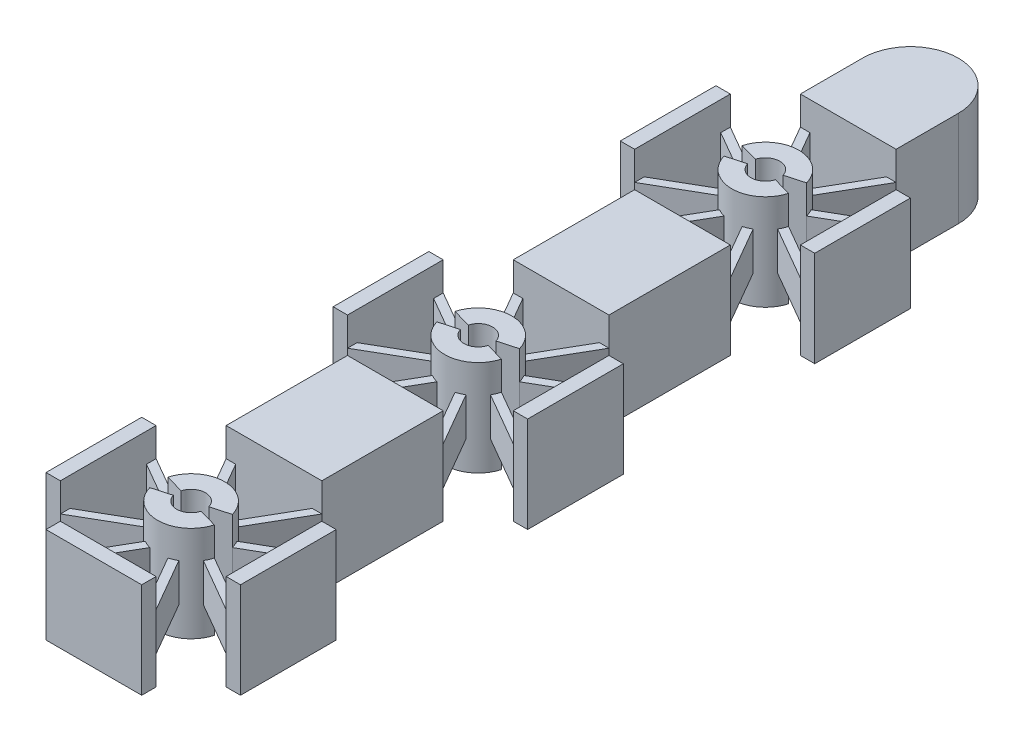
from build123d import *

# Parameters (mm, degrees)
SKETCH1_W                     = 10
SKETCH1_H                     = 1.5
BASE_BUTTERFLY_BLOCKS_DEPTH   = 5
SKETCH1_W_2                   = 1.5
SKETCH1_H_2                   = 10
BASE_BUTTERFLY_BLOCKS_2_DEPTH = 5
BASE_BUTTERFLY_BLOCKS_3_DEPTH = 5
BASE_BUTTERFLY_BLOCKS_4_DEPTH = 5
BASE_BUTTERFLY_BLOCKS_5_DEPTH = 5
BASE_BUTTERFLY_BLOCKS_6_DEPTH = 5
BASE_BUTTERFLY_FLEXURES_DEPTH = 2
LPATTERN1_COUNT               = 3
LPATTERN1_PITCH               = 30
SKETCH3_W                     = 10
SKETCH3_H                     = 10
PIP_DEPTH                     = 9.679491924
SKETCH5_W                     = 10
SKETCH5_H                     = 10
BOSS_EXTRUDE7_DEPTH           = 9.679491924
SKETCH6_W                     = 10
SKETCH6_H                     = 5
BOSS_EXTRUDE9_DEPTH           = 10


with BuildPart() as part:
    # Sketch1 → base_butterfly_blocks (new, symmetric)
    with BuildSketch(Plane(origin=(0, 0, 0), x_dir=(1, 0, 0), z_dir=(0, 1, 0))):
        with Locations((0, -9.410254038)):
            Rectangle(SKETCH1_W, SKETCH1_H)
    extrude(amount=BASE_BUTTERFLY_BLOCKS_DEPTH, both=True)



with BuildPart() as body_2:
    # Sketch1 → base_butterfly_blocks 2 (new, symmetric)
    with BuildSketch(Plane(origin=(0, 0, 0), x_dir=(1, 0, 0), z_dir=(0, 1, 0))):
        with Locations((-9.410254038, 0)):
            Rectangle(SKETCH1_W_2, SKETCH1_H_2)
    extrude(amount=BASE_BUTTERFLY_BLOCKS_2_DEPTH, both=True)


with BuildPart() as body_3:
    # Sketch1 → base_butterfly_blocks 3 (new, symmetric)
    with BuildSketch(Plane(origin=(0, 0, 0), x_dir=(1, 0, 0), z_dir=(0, 1, 0))):
        with Locations((0, 9.410254038)):
            Rectangle(SKETCH1_W, SKETCH1_H)
    extrude(amount=BASE_BUTTERFLY_BLOCKS_3_DEPTH, both=True)


with BuildPart() as body_4:
    # Sketch1 → base_butterfly_blocks 4 (new, symmetric)
    with BuildSketch(Plane(origin=(0, 0, 0), x_dir=(1, 0, 0), z_dir=(0, 1, 0))):
        with Locations((9.410254038, 0)):
            Rectangle(SKETCH1_W_2, SKETCH1_H_2)
    extrude(amount=BASE_BUTTERFLY_BLOCKS_4_DEPTH, both=True)


with BuildPart() as body_5:
    # Sketch1 → base_butterfly_blocks 5 (new, symmetric)
    with BuildSketch(Plane(origin=(0, 0, 0), x_dir=(1, 0, 0), z_dir=(0, 1, 0))):
        with BuildLine():
            Line((-1.444220457, 0.405249641), (-3.369847733, 0.945582496))
            ThreePointArc((-3.369847733, 0.945582496), (0, 3.5), (3.369847733, 0.945582496))
            Line((3.369847733, 0.945582496), (1.444220457, 0.405249641))
            ThreePointArc((1.444220457, 0.405249641), (0, 1.5), (-1.444220457, 0.405249641))
        make_face()
    extrude(amount=BASE_BUTTERFLY_BLOCKS_5_DEPTH, both=True)


with BuildPart() as body_6:
    # Sketch1 → base_butterfly_blocks 6 (new, symmetric)
    with BuildSketch(Plane(origin=(0, 0, 0), x_dir=(1, 0, 0), z_dir=(0, 1, 0))):
        with BuildLine():
            ThreePointArc((-1.444220457, -0.405249641), (0, -1.5), (1.444220457, -0.405249641))
            Line((1.444220457, -0.405249641), (3.369847733, -0.945582496))
            ThreePointArc((3.369847733, -0.945582496), (0, -3.5), (-3.369847733, -0.945582496))
            Line((-3.369847733, -0.945582496), (-1.444220457, -0.405249641))
        make_face()
    extrude(amount=BASE_BUTTERFLY_BLOCKS_6_DEPTH, both=True)


with BuildPart() as part_1:
    add(part.part)

    add(body_2.part)  # base_butterfly_flexures merges body 2

    add(body_3.part)  # base_butterfly_flexures merges body 3

    add(body_4.part)  # base_butterfly_flexures merges body 4

    add(body_5.part)  # base_butterfly_flexures merges body 5

    add(body_6.part)  # base_butterfly_flexures merges body 6
    # Sketch1<4> → base_butterfly_flexures (add, symmetric)
    with BuildSketch(Plane(origin=(0, 0, 0), x_dir=(1, 0, 0), z_dir=(0, 1, 0))):
        with BuildLine():
            Line((-8.660254038, 5), (-8.660254038, 4))
            Line((-8.660254038, 4), (-3.369847733, 0.945582496))
            ThreePointArc((-3.369847733, 0.945582496), (-3.225642474, 1.358392665), (-3.031088913, 1.75))
            Line((-3.031088913, 1.75), (-8.660254038, 5))
        make_face()
        with BuildLine():
            Line((-5, 8.660254038), (-1.75, 3.031088913))
            ThreePointArc((-1.75, 3.031088913), (-1.358392665, 3.225642474), (-0.945582496, 3.369847733))
            Line((-0.945582496, 3.369847733), (-4, 8.660254038))
            Line((-4, 8.660254038), (-5, 8.660254038))
        make_face()
        with BuildLine():
            Line((4, 8.660254038), (0.945582496, 3.369847733))
            ThreePointArc((0.945582496, 3.369847733), (1.358392665, 3.225642474), (1.75, 3.031088913))
            Line((1.75, 3.031088913), (5, 8.660254038))
            Line((5, 8.660254038), (4, 8.660254038))
        make_face()
        with BuildLine():
            Line((3.369847733, 0.945582496), (8.660254038, 4))
            Line((8.660254038, 4), (8.660254038, 5))
            Line((8.660254038, 5), (3.031088913, 1.75))
            ThreePointArc((3.031088913, 1.75), (3.225642474, 1.358392665), (3.369847733, 0.945582496))
        make_face()
        with BuildLine():
            ThreePointArc((3.369847733, -0.945582496), (3.225642474, -1.358392665), (3.031088913, -1.75))
            Line((3.031088913, -1.75), (8.660254038, -5))
            Line((8.660254038, -5), (8.660254038, -4))
            Line((8.660254038, -4), (3.369847733, -0.945582496))
        make_face()
        with BuildLine():
            ThreePointArc((1.75, -3.031088913), (1.358392665, -3.225642474), (0.945582496, -3.369847733))
            Line((0.945582496, -3.369847733), (4, -8.660254038))
            Line((4, -8.660254038), (5, -8.660254038))
            Line((5, -8.660254038), (1.75, -3.031088913))
        make_face()
        with BuildLine():
            ThreePointArc((-0.945582496, -3.369847733), (-1.358392665, -3.225642474), (-1.75, -3.031088913))
            Line((-1.75, -3.031088913), (-5, -8.660254038))
            Line((-5, -8.660254038), (-4, -8.660254038))
            Line((-4, -8.660254038), (-0.945582496, -3.369847733))
        make_face()
        with BuildLine():
            Line((-8.660254038, -5), (-3.031088913, -1.75))
            ThreePointArc((-3.031088913, -1.75), (-3.225642474, -1.358392665), (-3.369847733, -0.945582496))
            Line((-3.369847733, -0.945582496), (-8.660254038, -4))
            Line((-8.660254038, -4), (-8.660254038, -5))
        make_face()
    extrude(amount=BASE_BUTTERFLY_FLEXURES_DEPTH, both=True)


with BuildPart() as lpattern1_1:
    # LPattern1: pattern copy
    add(part_1.part.moved(Location(Vector(0, 0, -1) * (1 * LPATTERN1_PITCH))))


with BuildPart() as lpattern1_2:
    # LPattern1: pattern copy
    add(part_1.part.moved(Location(Vector(0, 0, -1) * (2 * LPATTERN1_PITCH))))


with BuildPart() as part_2:
    add(part_1.part)

    add(lpattern1_1.part)  # PIP merges LPattern1_1
    # Sketch3 → PIP (add)
    with BuildSketch(Plane(origin=(0, 0, -10.160254038), x_dir=(-1, 0, 0), z_dir=(0, 0, -1))):
        Rectangle(SKETCH3_W, SKETCH3_H)
    extrude(amount=PIP_DEPTH)

    add(lpattern1_2.part)  # Boss-Extrude7 merges LPattern1_2
    # Sketch5 → Boss-Extrude7 (add)
    with BuildSketch(Plane(origin=(0, 0, -40.160254038), x_dir=(-1, 0, 0), z_dir=(0, 0, -1))):
        Rectangle(SKETCH5_W, SKETCH5_H)
    extrude(amount=BOSS_EXTRUDE7_DEPTH)

    # Sketch6 → Boss-Extrude9 (add)
    with BuildSketch(Plane.XZ.offset(5)):
        with BuildLine():
            Line((-5, -75.160254038), (5, -75.160254038))
            ThreePointArc((5, -75.160254038), (0, -80.160254038), (-5, -75.160254038))
        make_face()
        with Locations((0, -72.660254038)):
            Rectangle(SKETCH6_W, SKETCH6_H)
    extrude(amount=-BOSS_EXTRUDE9_DEPTH)


solid = part_2.part
